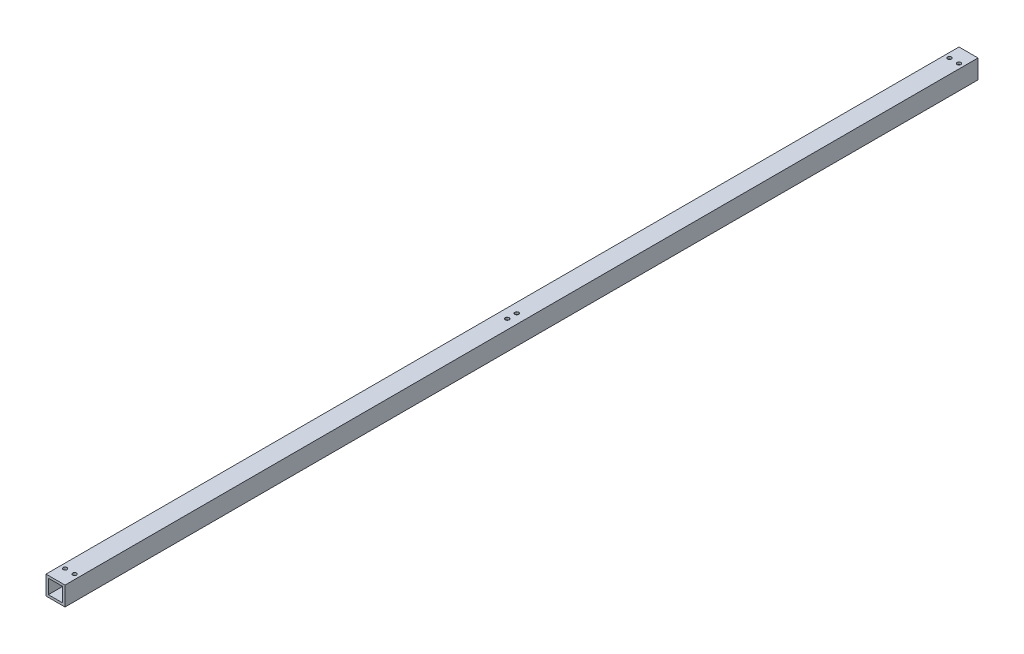
from build123d import *

# Parameters (mm, degrees)
EXTRUDE_THIN1_START             = 508
SKETCH5_W                       = 25.4
SKETCH5_H                       = 25.4
SKETCH5_W_2                     = 19.05
SKETCH5_H_2                     = 19.05
EXTRUDE_THIN1_DEPTH             = 1219.2
F_5_0MM_DOWEL_HOLE1_D           = 5
F_5_0MM_DOWEL_HOLE1_CSINK_D     = 5.05
F_5_0MM_DOWEL_HOLE1_CSINK_ANGLE = 90


with BuildPart() as part:
    # Sketch5 → Extrude-Thin1 (new body)
    with BuildSketch(Plane.XY.offset(EXTRUDE_THIN1_START)):
        with Locations((63.5, 83.82)):
            Rectangle(SKETCH5_W, SKETCH5_H)
        with Locations((63.5, 83.82)):
            Rectangle(SKETCH5_W_2, SKETCH5_H_2, mode=Mode.SUBTRACT)
    extrude(amount=-EXTRUDE_THIN1_DEPTH)

    # Ø5.0mm Dowel Hole1 (through all)
    with Locations(Plane(origin=(0, 96.52, 0), x_dir=(1, 0, 0), z_dir=(0, 1, 0))):
        with Locations((63.5, 107.95), (63.5, 95.25), (57.15, 692.15), (69.85, 692.15)):
            f_5_0mm_dowel_hole1 = CounterSinkHole(F_5_0MM_DOWEL_HOLE1_D / 2, F_5_0MM_DOWEL_HOLE1_CSINK_D / 2, counter_sink_angle=F_5_0MM_DOWEL_HOLE1_CSINK_ANGLE)

    # Mirror1: Ø5.0mm Dowel Hole1 across plane
    add(f_5_0mm_dowel_hole1.mirror(Plane.XY.offset(-101.6)), mode=Mode.SUBTRACT)


solid = part.part
